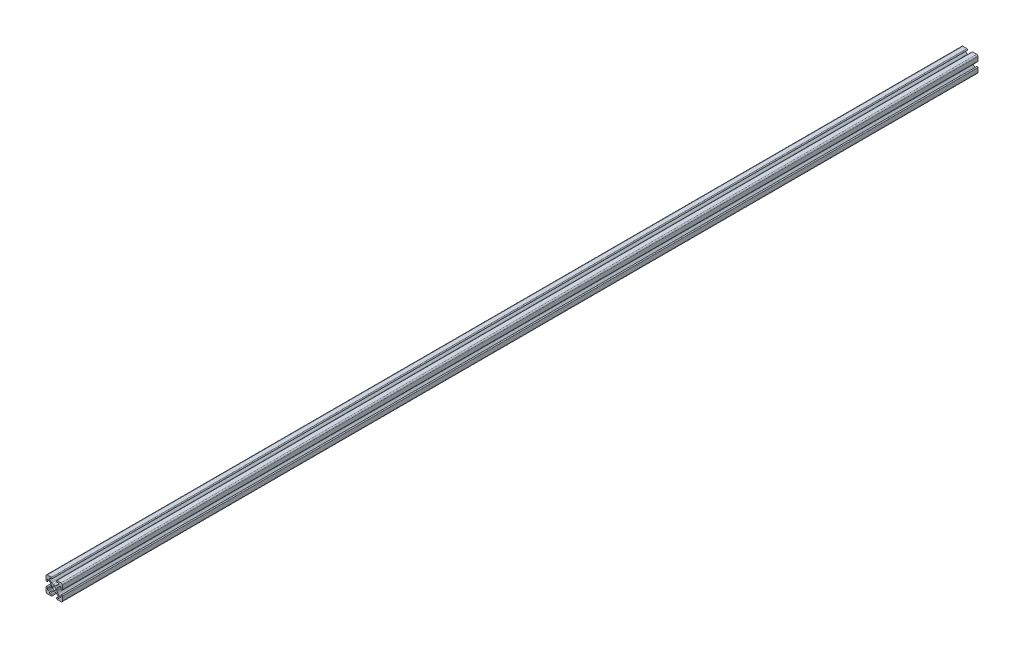
from build123d import *

# Parameters (mm, degrees)
SKETCH1_R           = 2.5
BOSS_EXTRUDE1_DEPTH = 1400


with BuildPart() as part:
    # Sketch1 → Boss-Extrude1 (new body)
    with BuildSketch(Plane(origin=(0, 0, -500), x_dir=(-1, 0, 0), z_dir=(0, 0, -1))):
        with BuildLine():
            Line((12.5, 4.32), (12.5, 10.537068835))
            ThreePointArc((12.5, 10.537068835), (11.925070773, 11.925070773), (10.537068835, 12.5))
            Line((10.537068835, 12.5), (4.32, 12.5))
            ThreePointArc((4.32, 12.5), (3.25, 11.43), (4.32, 10.36))
            Line((4.32, 10.36), (6.42, 10.36))
            ThreePointArc((6.42, 10.36), (7.35325999, 9.736168088), (7.133653912, 8.635298598))
            Line((7.133653912, 8.635298598), (3.795290766, 5.301828272))
            ThreePointArc((3.795290766, 5.301828272), (2.76743922, 4.61585726), (1.555406707, 4.375))
            Line((1.555406707, 4.375), (-1.555406707, 4.375))
            ThreePointArc((-1.555406707, 4.375), (-2.76743922, 4.61585726), (-3.795290766, 5.301828272))
            Line((-3.795290766, 5.301828272), (-7.133653912, 8.635298598))
            ThreePointArc((-7.133653912, 8.635298598), (-7.35325999, 9.736168088), (-6.42, 10.36))
            Line((-6.42, 10.36), (-4.32, 10.36))
            ThreePointArc((-4.32, 10.36), (-3.25, 11.43), (-4.32, 12.5))
            Line((-4.32, 12.5), (-10.537068835, 12.5))
            ThreePointArc((-10.537068835, 12.5), (-11.925070773, 11.925070773), (-12.5, 10.537068835))
            Line((-12.5, 10.537068835), (-12.5, 4.32))
            ThreePointArc((-12.5, 4.32), (-11.43, 3.25), (-10.36, 4.32))
            Line((-10.36, 4.32), (-10.36, 6.396886949))
            ThreePointArc((-10.36, 6.396886949), (-9.736852394, 7.329863489), (-8.636346088, 7.111588351))
            Line((-8.636346088, 7.111588351), (-5.432204773, 3.912143135))
            ThreePointArc((-5.432204773, 3.912143135), (-4.708985779, 2.831057106), (-4.455, 1.555406707))
            Line((-4.455, 1.555406707), (-4.455, -1.555406707))
            ThreePointArc((-4.455, -1.555406707), (-4.708985779, -2.831057106), (-5.432204773, -3.912143135))
            Line((-5.432204773, -3.912143135), (-8.636346088, -7.111588351))
            ThreePointArc((-8.636346088, -7.111588351), (-9.736852394, -7.329863489), (-10.36, -6.396886949))
            Line((-10.36, -6.396886949), (-10.36, -4.32))
            ThreePointArc((-10.36, -4.32), (-11.43, -3.25), (-12.5, -4.32))
            Line((-12.5, -4.32), (-12.5, -10.537068835))
            ThreePointArc((-12.5, -10.537068835), (-11.925070773, -11.925070773), (-10.537068835, -12.5))
            Line((-10.537068835, -12.5), (-4.387856959, -12.5))
            ThreePointArc((-4.387856959, -12.5), (-3.317856959, -11.43), (-4.387856959, -10.36))
            Line((-4.387856959, -10.36), (-6.42, -10.36))
            ThreePointArc((-6.42, -10.36), (-7.35325999, -9.736168088), (-7.133653912, -8.635298598))
            Line((-7.133653912, -8.635298598), (-3.795290766, -5.301828272))
            ThreePointArc((-3.795290766, -5.301828272), (-2.76743922, -4.61585726), (-1.555406707, -4.375))
            Line((-1.555406707, -4.375), (1.555406707, -4.375))
            ThreePointArc((1.555406707, -4.375), (2.76743922, -4.61585726), (3.795290766, -5.301828272))
            Line((3.795290766, -5.301828272), (7.133653912, -8.635298598))
            ThreePointArc((7.133653912, -8.635298598), (7.35325999, -9.736168088), (6.42, -10.36))
            Line((6.42, -10.36), (4.387856959, -10.36))
            ThreePointArc((4.387856959, -10.36), (3.317856959, -11.43), (4.387856959, -12.5))
            Line((4.387856959, -12.5), (10.537068835, -12.5))
            ThreePointArc((10.537068835, -12.5), (11.925070773, -11.925070773), (12.5, -10.537068835))
            Line((12.5, -10.537068835), (12.5, -4.32))
            ThreePointArc((12.5, -4.32), (11.43, -3.25), (10.36, -4.32))
            Line((10.36, -4.32), (10.36, -6.396886949))
            ThreePointArc((10.36, -6.396886949), (9.736852394, -7.329863489), (8.636346088, -7.111588351))
            Line((8.636346088, -7.111588351), (5.432204773, -3.912143135))
            ThreePointArc((5.432204773, -3.912143135), (4.708985779, -2.831057106), (4.455, -1.555406707))
            Line((4.455, -1.555406707), (4.455, 1.555406707))
            ThreePointArc((4.455, 1.555406707), (4.708985779, 2.831057106), (5.432204773, 3.912143135))
            Line((5.432204773, 3.912143135), (8.636346088, 7.111588351))
            ThreePointArc((8.636346088, 7.111588351), (9.736852394, 7.329863489), (10.36, 6.396886949))
            Line((10.36, 6.396886949), (10.36, 4.32))
            ThreePointArc((10.36, 4.32), (11.43, 3.25), (12.5, 4.32))
        make_face()
        with Locations(Location((0, 0, 0), (0, 0, 180))):
            Circle(SKETCH1_R, mode=Mode.SUBTRACT)
    extrude(amount=-BOSS_EXTRUDE1_DEPTH)


solid = part.part
